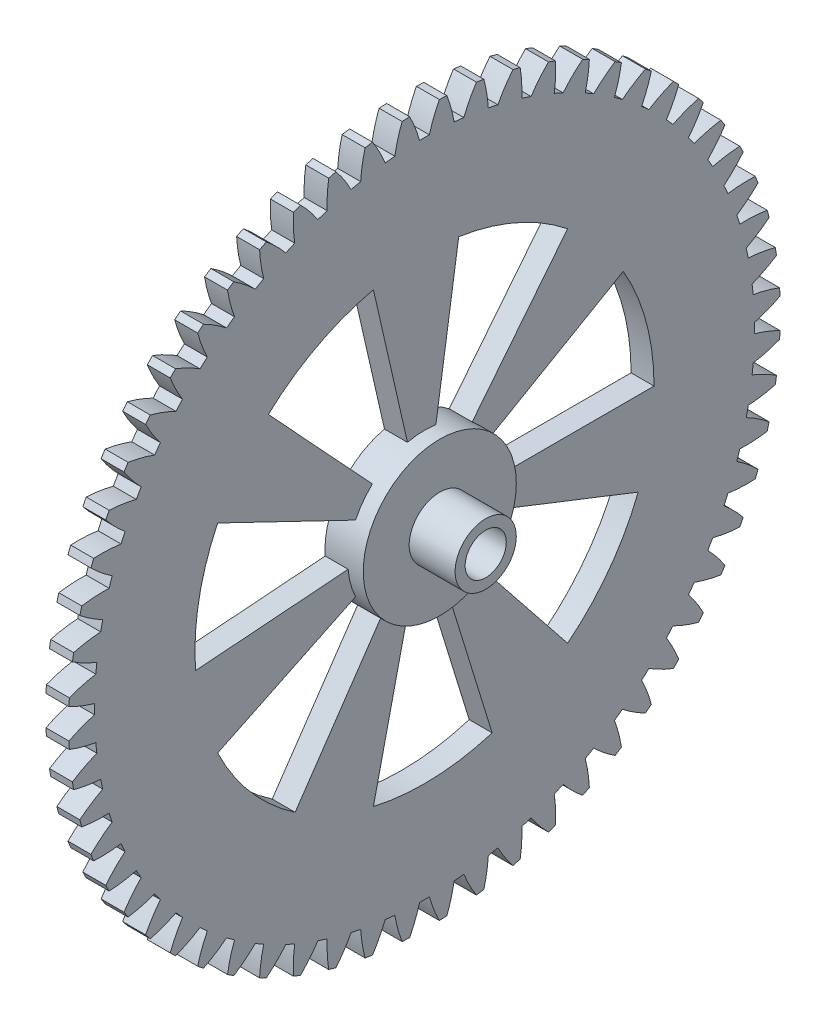
from build123d import *

# Parameters (mm, degrees)
BASPROSKE_W         = 3
BASPROSKE_H         = 46.5
TOOTHCUT_DEPTH      = 66.829324772
TEETHCUTS_COUNT     = 60
TEETHCUTS_ANGLE     = 354
BORSKE_R            = 0.5
BORE_DEPTH          = 50.0000508
CUT_EXTRUDE1_REACH  = 67.772
SKETCH1_R           = 6.4
CUT_EXTRUDE2_REACH  = 67.772
BOSS_EXTRUDE1_START = 2
SKETCH4_R           = 10
SKETCH4_R_2         = 2.69
BOSS_EXTRUDE1_DEPTH = 2
BOSS_EXTRUDE2_START = 6
SKETCH5_R           = 4
SKETCH5_R_2         = 2.69
BOSS_EXTRUDE2_DEPTH = 6


with BuildPart() as part:
    # BasProSke → Base-Revolve (revolve)
    with BuildSketch(Plane(origin=(0, 0, 0), x_dir=(1, 0, 0), z_dir=(0, 1, 0)), mode=Mode.PRIVATE) as base_revolve_sk:
        with Locations((1.5, 23.25)):
            Rectangle(BASPROSKE_W, BASPROSKE_H)
    revolve(base_revolve_sk.sketch.rotate(Axis((-10, 0, 0), (1, 0, 0)), 180), axis=Axis((-10, 0, 0), (1, 0, 0)))

    # TooCutSke → ToothCut (cut, through all)
    with BuildSketch(Plane(origin=(0, 0, 0), x_dir=(0, 0, -1), z_dir=(1, 0, 0))):
        with BuildLine():
            ThreePointArc((0.638657789, 43.119270544), (0, 43.124), (-0.638657789, 43.119270544))
            ThreePointArc((-0.638657789, 43.119270544), (-1.21237986, 44.83490593), (-1.955410143, 46.484289995))
            ThreePointArc((-1.955410143, 46.484289995), (0, 46.5254), (1.955410143, 46.484289995))
            ThreePointArc((1.955410143, 46.484289995), (1.21237986, 44.83490593), (0.638657789, 43.119270544))
        make_face()
    toothcut = extrude(amount=TOOTHCUT_DEPTH, mode=Mode.SUBTRACT)

    # TeethCuts: ToothCut ×60 about axis
    teethcuts_axis = Axis((-10, 0, 0), (1, 0, 0))
    for i in range(1, TEETHCUTS_COUNT):
        add(toothcut.rotate(teethcuts_axis, i * TEETHCUTS_ANGLE / (TEETHCUTS_COUNT - 1)), mode=Mode.SUBTRACT)

    # BorSke → Bore (cut, symmetric)
    with BuildSketch(Plane(origin=(0, 0, 0), x_dir=(0, 0, -1), z_dir=(1, 0, 0))):
        with Locations(Location((0, 0, 0), (0, 0, 180))):
            Circle(BORSKE_R)
    extrude(amount=BORE_DEPTH, both=True, mode=Mode.SUBTRACT)

    # Sketch1 → Cut-Extrude1 (cut, up to next)
    with BuildSketch(Plane(origin=(3, 0, 0), x_dir=(0, 0, -1), z_dir=(1, 0, 0)), mode=Mode.PRIVATE) as cut_extrude1_sk1:
        Circle(SKETCH1_R)
    cut_extrude1_tool1 = extrude(cut_extrude1_sk1.sketch, amount=-CUT_EXTRUDE1_REACH, mode=Mode.PRIVATE) & part.part
    add(cut_extrude1_tool1.solids().sort_by_distance((3, 0, 0))[0], mode=Mode.SUBTRACT)

    # Sketch3 → Cut-Extrude2 (cut, up to next)
    with BuildSketch(Plane(origin=(3, 0, 0), x_dir=(0, 0, -1), z_dir=(1, 0, 0)), mode=Mode.PRIVATE) as cut_extrude2_sk1:
        with BuildLine():
            Line((8.660254038, 5), (25.980762114, 15))
            ThreePointArc((25.980762114, 15), (28.977774789, 7.764571353), (30, 0))
            Line((30, 0), (10, 0))
            ThreePointArc((10, 0), (9.659258263, 2.588190451), (8.660254038, 5))
        make_face()
    cut_extrude2_tool1 = extrude(cut_extrude2_sk1.sketch, amount=-CUT_EXTRUDE2_REACH, mode=Mode.PRIVATE) & part.part
    # Sketch3 → Cut-Extrude2 (cut, up to next)
    with BuildSketch(Plane(origin=(3, 0, 0), x_dir=(0, 0, -1), z_dir=(1, 0, 0)), mode=Mode.PRIVATE) as cut_extrude2_sk2:
        with BuildLine():
            Line((9.308737486, -3.653410244), (27.926212459, -10.960230731))
            ThreePointArc((27.926212459, -10.960230731), (24.137933393, -17.814605567), (18.704694056, -23.454944474))
            Line((18.704694056, -23.454944474), (6.234898019, -7.818314825))
            ThreePointArc((6.234898019, -7.818314825), (8.045977798, -5.938201856), (9.308737486, -3.653410244))
        make_face()
    cut_extrude2_tool2 = extrude(cut_extrude2_sk2.sketch, amount=-CUT_EXTRUDE2_REACH, mode=Mode.PRIVATE) & part.part
    # Sketch3 → Cut-Extrude2 (cut, up to next)
    with BuildSketch(Plane(origin=(3, 0, 0), x_dir=(0, 0, -1), z_dir=(1, 0, 0)), mode=Mode.PRIVATE) as cut_extrude2_sk3:
        with BuildLine():
            Line((2.947551744, -9.555728058), (8.842655232, -28.667184174))
            ThreePointArc((8.842655232, -28.667184174), (1.121735828, -29.979021144), (-6.675628019, -29.247837365))
            Line((-6.675628019, -29.247837365), (-2.22520934, -9.749279122))
            ThreePointArc((-2.22520934, -9.749279122), (0.373911943, -9.993007048), (2.947551744, -9.555728058))
        make_face()
    cut_extrude2_tool3 = extrude(cut_extrude2_sk3.sketch, amount=-CUT_EXTRUDE2_REACH, mode=Mode.PRIVATE) & part.part
    # Sketch3 → Cut-Extrude2 (cut, up to next)
    with BuildSketch(Plane(origin=(3, 0, 0), x_dir=(0, 0, -1), z_dir=(1, 0, 0)), mode=Mode.PRIVATE) as cut_extrude2_sk4:
        with BuildLine():
            Line((-5.633200581, -8.262387743), (-16.899601742, -24.787163229))
            ThreePointArc((-16.899601742, -24.787163229), (-22.739151694, -19.568622338), (-27.029066037, -13.016512174))
            Line((-27.029066037, -13.016512174), (-9.009688679, -4.338837391))
            ThreePointArc((-9.009688679, -4.338837391), (-7.579717231, -6.522874113), (-5.633200581, -8.262387743))
        make_face()
    cut_extrude2_tool4 = extrude(cut_extrude2_sk4.sketch, amount=-CUT_EXTRUDE2_REACH, mode=Mode.PRIVATE) & part.part
    # Sketch3 → Cut-Extrude2 (cut, up to next)
    with BuildSketch(Plane(origin=(3, 0, 0), x_dir=(0, 0, -1), z_dir=(1, 0, 0)), mode=Mode.PRIVATE) as cut_extrude2_sk5:
        with BuildLine():
            Line((-9.972037972, -0.747300936), (-29.916113915, -2.241902808))
            ThreePointArc((-29.916113915, -2.241902808), (-29.476994197, 5.577348215), (-27.029066037, 13.016512174))
            Line((-27.029066037, 13.016512174), (-9.009688679, 4.338837391))
            ThreePointArc((-9.009688679, 4.338837391), (-9.825664732, 1.859116072), (-9.972037972, -0.747300936))
        make_face()
    cut_extrude2_tool5 = extrude(cut_extrude2_sk5.sketch, amount=-CUT_EXTRUDE2_REACH, mode=Mode.PRIVATE) & part.part
    # Sketch3 → Cut-Extrude2 (cut, up to next)
    with BuildSketch(Plane(origin=(3, 0, 0), x_dir=(0, 0, -1), z_dir=(1, 0, 0)), mode=Mode.PRIVATE) as cut_extrude2_sk6:
        with BuildLine():
            Line((-6.801727378, 7.330518718), (-20.405182133, 21.991556155))
            ThreePointArc((-20.405182133, 21.991556155), (-14.018058848, 26.523461805), (-6.675628019, 29.247837365))
            Line((-6.675628019, 29.247837365), (-2.22520934, 9.749279122))
            ThreePointArc((-2.22520934, 9.749279122), (-4.672686283, 8.841153935), (-6.801727378, 7.330518718))
        make_face()
    cut_extrude2_tool6 = extrude(cut_extrude2_sk6.sketch, amount=-CUT_EXTRUDE2_REACH, mode=Mode.PRIVATE) & part.part
    # Sketch3 → Cut-Extrude2 (cut, up to next)
    with BuildSketch(Plane(origin=(3, 0, 0), x_dir=(0, 0, -1), z_dir=(1, 0, 0)), mode=Mode.PRIVATE) as cut_extrude2_sk7:
        with BuildLine():
            Line((1.490422662, 9.888308262), (4.471267985, 29.664924787))
            ThreePointArc((4.471267985, 29.664924787), (11.99676073, 27.496867676), (18.704694056, 23.454944474))
            Line((18.704694056, 23.454944474), (6.234898019, 7.818314825))
            ThreePointArc((6.234898019, 7.818314825), (3.998920243, 9.165622559), (1.490422662, 9.888308262))
        make_face()
    cut_extrude2_tool7 = extrude(cut_extrude2_sk7.sketch, amount=-CUT_EXTRUDE2_REACH, mode=Mode.PRIVATE) & part.part
    add(cut_extrude2_tool1.solids().sort_by_distance((3, 5.543907, -20.690143))[0], mode=Mode.SUBTRACT)
    add(cut_extrude2_tool2.solids().sort_by_distance((3, -12.719635, -17.234494))[0], mode=Mode.SUBTRACT)
    add(cut_extrude2_tool3.solids().sort_by_distance((3, -21.405033, -0.80092))[0], mode=Mode.SUBTRACT)
    add(cut_extrude2_tool4.solids().sort_by_distance((3, -13.972004, 16.235763))[0], mode=Mode.SUBTRACT)
    add(cut_extrude2_tool5.solids().sort_by_distance((3, 3.982229, 21.046585))[0], mode=Mode.SUBTRACT)
    add(cut_extrude2_tool6.solids().sort_by_distance((3, 18.937762, 10.0089))[0], mode=Mode.SUBTRACT)
    add(cut_extrude2_tool7.solids().sort_by_distance((3, 19.632774, -8.565692))[0], mode=Mode.SUBTRACT)

    # Sketch4 → Boss-Extrude1 (add)
    with BuildSketch(Plane(origin=(3, 0, 0), x_dir=(0, 0, -1), z_dir=(1, 0, 0)).offset(BOSS_EXTRUDE1_START)):
        Circle(SKETCH4_R)
        Circle(SKETCH4_R_2, mode=Mode.SUBTRACT)
    extrude(amount=-BOSS_EXTRUDE1_DEPTH)

    # Sketch5 → Boss-Extrude2 (add)
    with BuildSketch(Plane(origin=(5, 0, 0), x_dir=(0, 0, -1), z_dir=(1, 0, 0)).offset(BOSS_EXTRUDE2_START)):
        Circle(SKETCH5_R)
        Circle(SKETCH5_R_2, mode=Mode.SUBTRACT)
    extrude(amount=-BOSS_EXTRUDE2_DEPTH)


solid = part.part
